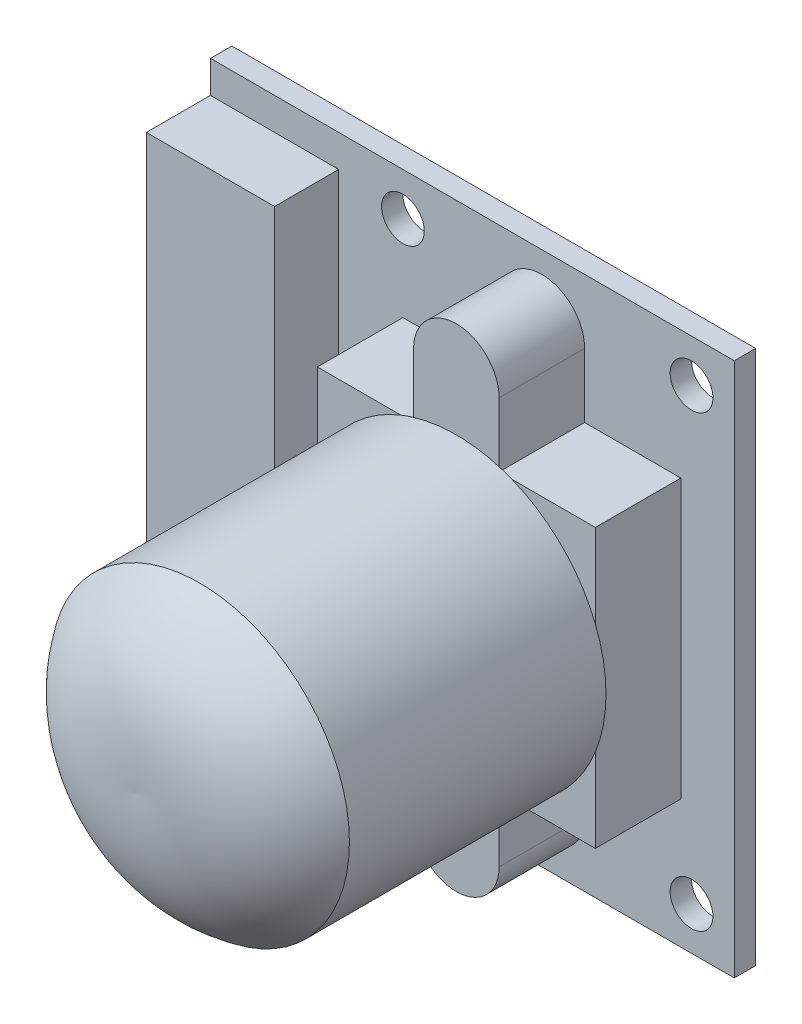
from build123d import *

# Parameters (mm, degrees)
SKETCH1_W           = 24.5
SKETCH1_H           = 25
BOSS_EXTRUDE1_DEPTH = 1
SKETCH2_W           = 6
SKETCH2_H           = 22
BOSS_EXTRUDE2_DEPTH = 3
SKETCH3_R           = 1
CUT_EXTRUDE1_DEPTH  = 18.757040857
SKETCH4_R           = 2
SKETCH4_W           = 13
SKETCH4_H           = 13
BOSS_EXTRUDE3_DEPTH = 4
SKETCH5_R           = 7
BOSS_EXTRUDE4_DEPTH = 12


with BuildPart() as part:
    # Sketch1 → Boss-Extrude1 (new body)
    with BuildSketch(Plane.XY):
        Rectangle(SKETCH1_W, SKETCH1_H)
    extrude(amount=BOSS_EXTRUDE1_DEPTH)

    # Sketch2 → Boss-Extrude2 (add)
    with BuildSketch(Plane.XY.offset(1)):
        with Locations((-9.25, 0)):
            Rectangle(SKETCH2_W, SKETCH2_H)
    extrude(amount=BOSS_EXTRUDE2_DEPTH)

    # Sketch3 → Cut-Extrude1 (cut, through all)
    with BuildSketch(Plane.XY.offset(1)):
        with Locations((10.25, 10.5)):
            Circle(SKETCH3_R)
        with Locations((10.25, -10.5)):
            Circle(SKETCH3_R)
        with Locations((-3.25, 10.5)):
            Circle(SKETCH3_R)
        with Locations((-3.25, -10.5)):
            Circle(SKETCH3_R)
    extrude(amount=-CUT_EXTRUDE1_DEPTH, mode=Mode.SUBTRACT)

    # Sketch4 → Boss-Extrude3 (add)
    with BuildSketch(Plane.XY.offset(1)):
        with Locations((3.25, 9.5)):
            Circle(SKETCH4_R)
        with BuildLine():
            Line((5.25, 6.5), (5.25, 9.5))
            ThreePointArc((5.25, 9.5), (3.25, 7.5), (1.25, 9.5))
            Line((1.25, 9.5), (1.25, 6.5))
            Line((1.25, 6.5), (5.25, 6.5))
        make_face()
        with Locations((3.25, 0)):
            Rectangle(SKETCH4_W, SKETCH4_H)
        with Locations((3.25, -9.5)):
            Circle(SKETCH4_R)
        with BuildLine():
            Line((5.25, -9.5), (5.25, -6.5))
            Line((5.25, -6.5), (1.25, -6.5))
            Line((1.25, -6.5), (1.25, -9.5))
            ThreePointArc((1.25, -9.5), (3.25, -7.5), (5.25, -9.5))
        make_face()
    extrude(amount=BOSS_EXTRUDE3_DEPTH)

    # Sketch5 → Boss-Extrude4 (add)
    with BuildSketch(Plane.XY.offset(5)):
        with Locations(Location((3.25, 0, 0), (0, 0, 158.213210702))):
            Circle(SKETCH5_R)
    extrude(amount=BOSS_EXTRUDE4_DEPTH)

    # Sketch7 → Revolve1 (revolve)
    with BuildSketch(Plane(origin=(0, 0, 0), x_dir=(1, 0, 0), z_dir=(0, 1, 0))):
        with BuildLine():
            Line((3.25, -17), (3.25, -20))
            add(Edge.make_bspline(
                [(-3.75, -17), (-1.521062197, -20.264896089), (3.25, -20)],
                knots=[0, 0, 0, 1, 1, 1], degree=2))
            Line((-3.75, -17), (3.25, -17))
        make_face()
    revolve(axis=Axis((3.25, 0, 17), (0, 0, 1)))


solid = part.part
